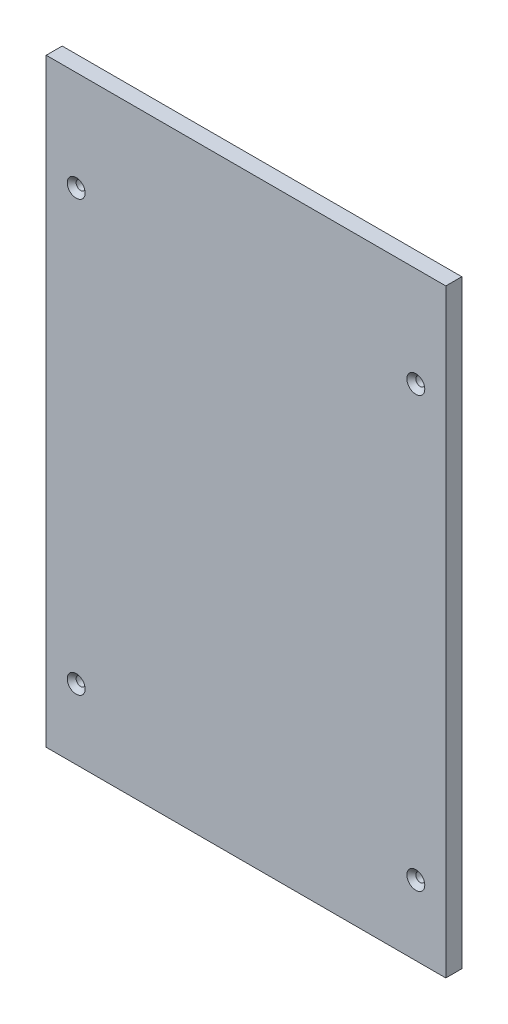
from build123d import *

# Parameters (mm, degrees)
ESBO_O1_W                            = 200
ESBO_O1_H                            = 300
RESSALTO_EXTRUS_O1_DEPTH             = 8
ESCAREADO_PARA_SFHCS_M41_D           = 4.5
ESCAREADO_PARA_SFHCS_M41_CSINK_D     = 8.96
ESCAREADO_PARA_SFHCS_M41_CSINK_ANGLE = 90


with BuildPart() as part:
    # Esboço1 → Ressalto-extrusão1 (new body)
    with BuildSketch(Plane.XY):
        with Locations((100, 150)):
            Rectangle(ESBO_O1_W, ESBO_O1_H)
    extrude(amount=RESSALTO_EXTRUS_O1_DEPTH)

    # Escareado para SFHCS M41 (through all)
    with Locations(Plane(origin=(15, 250, 8), x_dir=(1, 0, 0), z_dir=(0, 0, 1))):
        with Locations((0, 0), (170, 0), (0, -215), (170, -215)):
            CounterSinkHole(ESCAREADO_PARA_SFHCS_M41_D / 2, ESCAREADO_PARA_SFHCS_M41_CSINK_D / 2, counter_sink_angle=ESCAREADO_PARA_SFHCS_M41_CSINK_ANGLE)


solid = part.part
